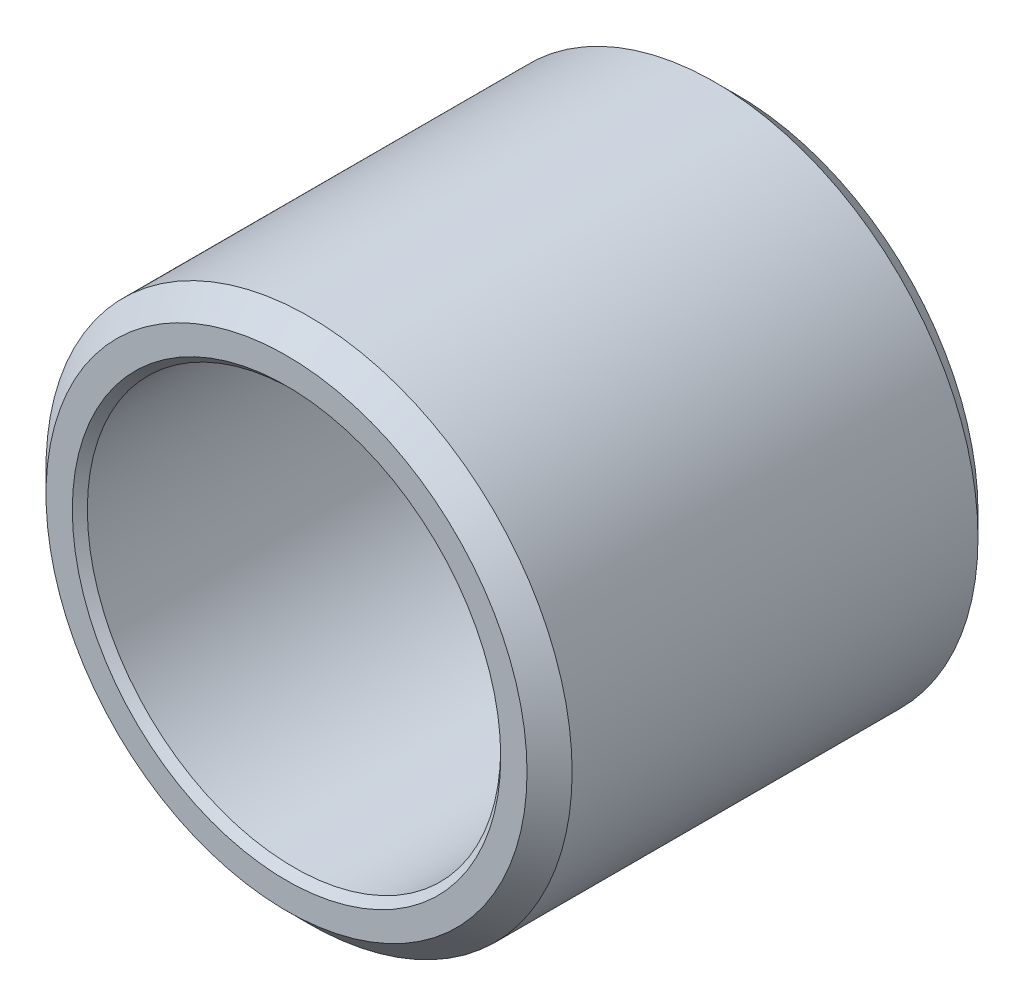
from build123d import *

# Parameters (mm, degrees)
SKETCH_1_R      = 35
SKETCH_1_R_2    = 27.5
EXTRUDE_1_DEPTH = 60
CHAMFER_1_SIZE  = 3
SKETCH_2_W      = 29
SKETCH_2_H      = 2.2
CHAMFER_2_SIZE  = 1


with BuildPart() as part:
    # 草图1 → 凸台-拉伸1 (new body)
    with BuildSketch(Plane.XY):
        Circle(SKETCH_1_R)
        Circle(SKETCH_1_R_2, mode=Mode.SUBTRACT)
    extrude(amount=EXTRUDE_1_DEPTH)

    # 倒角1
    chamfer_1_edges = [part.edges().sort_by_distance(p)[0] for p in [
        (-35, 0, 0),
        (-35, 0, 60),
    ]]
    chamfer(chamfer_1_edges, length=CHAMFER_1_SIZE)

    # 草图2 → 切除-旋转1 (revolve, cut)
    with BuildSketch(Plane(origin=(0, 0, 0), x_dir=(1, 0, 0), z_dir=(0, 1, 0)), mode=Mode.PRIVATE) as cut_revolve_1_sk:
        with Locations((14.5, -5.6)):
            Rectangle(SKETCH_2_W, SKETCH_2_H)
    revolve(cut_revolve_1_sk.sketch.rotate(Axis((0, 0, 0), (0, 0, 1)), 180), axis=Axis((0, 0, 0), (0, 0, 1)), mode=Mode.SUBTRACT)

    # 倒角2
    chamfer_2_edges = [part.edges().sort_by_distance(p)[0] for p in [
        (-27.5, 0, 0),
        (-27.5, 0, 60),
    ]]
    chamfer(chamfer_2_edges, length=CHAMFER_2_SIZE)


solid = part.part
